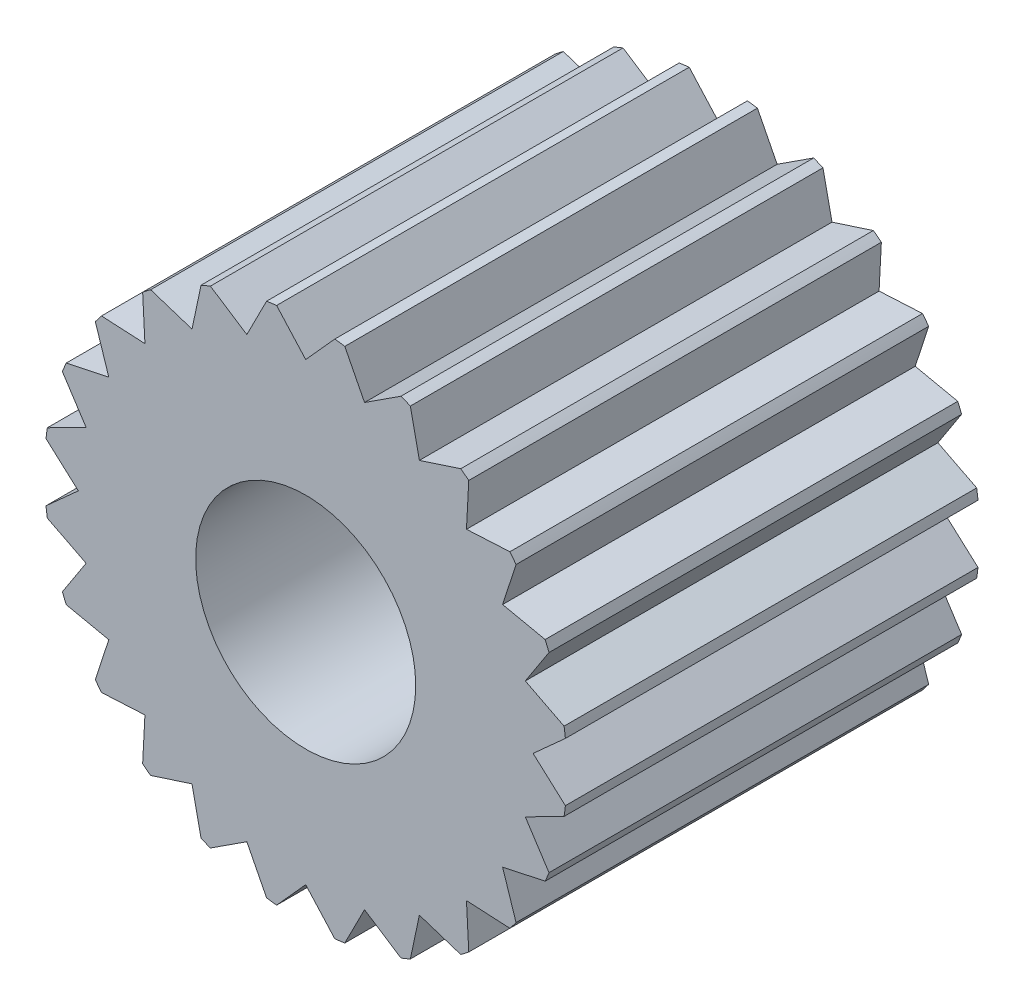
from build123d import *

# Parameters (mm, degrees)
ESBO_O1_R                = 1.9
ESBO_O1_R_2              = 0.8
RESSALTO_EXTRUS_O1_DEPTH = 3
CORTE_EXTRUS_O2_DEPTH    = 5.027406113


with BuildPart() as part:
    # Esboço1 → Ressalto-extrusão1 (new body)
    with BuildSketch(Plane.XY):
        Circle(ESBO_O1_R)
        Circle(ESBO_O1_R_2, mode=Mode.SUBTRACT)
    extrude(amount=RESSALTO_EXTRUS_O1_DEPTH)

    # Esboço2 → Corte-extrusão2 (cut, through all)
    with BuildSketch(Plane.XY.offset(3)):
        with BuildLine():
            Line((-0.211558753, 1.888185079), (0, 1.653119799))
            Line((0, 1.653119799), (0.211558753, 1.888185079))
            ThreePointArc((0.211558753, 1.888185079), (0, 1.9), (-0.211558753, 1.888185079))
        make_face()
        with BuildLine():
            ThreePointArc((0.693048322, 1.769091299), (0.491756186, 1.83525907), (0.284348196, 1.878602167))
            Line((0.284348196, 1.878602167), (0.427858888, 1.596791107))
            Line((0.427858888, 1.596791107), (0.693048322, 1.769091299))
        make_face()
        with BuildLine():
            Line((-0.427858888, 1.596791107), (-0.284348196, 1.878602167))
            ThreePointArc((-0.284348196, 1.878602167), (-0.491756186, 1.83525907), (-0.693048322, 1.769091299))
            Line((-0.693048322, 1.769091299), (-0.427858888, 1.596791107))
        make_face()
        with BuildLine():
            ThreePointArc((1.127307794, 1.529436869), (0.95, 1.645448267), (0.760877285, 1.740995622))
            Line((0.760877285, 1.740995622), (0.826559899, 1.431643741))
            Line((0.826559899, 1.431643741), (1.127307794, 1.529436869))
        make_face()
        with BuildLine():
            Line((-0.826559899, 1.431643741), (-0.760877285, 1.740995622))
            ThreePointArc((-0.760877285, 1.740995622), (-0.95, 1.645448267), (-1.127307794, 1.529436869))
            Line((-1.127307794, 1.529436869), (-0.826559899, 1.431643741))
        make_face()
        with BuildLine():
            ThreePointArc((1.484743102, 1.185553845), (1.343502884, 1.343502884), (1.185553845, 1.484743102))
            Line((1.185553845, 1.484743102), (1.16893222, 1.16893222))
            Line((1.16893222, 1.16893222), (1.484743102, 1.185553845))
        make_face()
        with BuildLine():
            Line((-1.16893222, 1.16893222), (-1.185553845, 1.484743102))
            ThreePointArc((-1.185553845, 1.484743102), (-1.343502884, 1.343502884), (-1.484743102, 1.185553845))
            Line((-1.484743102, 1.185553845), (-1.16893222, 1.16893222))
        make_face()
        with BuildLine():
            ThreePointArc((1.740995622, 0.760877285), (1.645448267, 0.95), (1.529436869, 1.127307794))
            Line((1.529436869, 1.127307794), (1.431643741, 0.826559899))
            Line((1.431643741, 0.826559899), (1.740995622, 0.760877285))
        make_face()
        with BuildLine():
            Line((-1.431643741, 0.826559899), (-1.529436869, 1.127307794))
            ThreePointArc((-1.529436869, 1.127307794), (-1.645448267, 0.95), (-1.740995622, 0.760877285))
            Line((-1.740995622, 0.760877285), (-1.431643741, 0.826559899))
        make_face()
        with BuildLine():
            ThreePointArc((1.878602167, 0.284348196), (1.83525907, 0.491756186), (1.769091299, 0.693048322))
            Line((1.769091299, 0.693048322), (1.596791107, 0.427858888))
            Line((1.596791107, 0.427858888), (1.878602167, 0.284348196))
        make_face()
        with BuildLine():
            Line((-1.596791107, 0.427858888), (-1.769091299, 0.693048322))
            ThreePointArc((-1.769091299, 0.693048322), (-1.83525907, 0.491756186), (-1.878602167, 0.284348196))
            Line((-1.878602167, 0.284348196), (-1.596791107, 0.427858888))
        make_face()
        with BuildLine():
            ThreePointArc((1.888185079, -0.211558753), (1.9, 0), (1.888185079, 0.211558753))
            Line((1.888185079, 0.211558753), (1.653119799, 0))
            Line((1.653119799, 0), (1.888185079, -0.211558753))
        make_face()
        with BuildLine():
            Line((-1.653119799, 0), (-1.888185079, 0.211558753))
            ThreePointArc((-1.888185079, 0.211558753), (-1.9, 0), (-1.888185079, -0.211558753))
            Line((-1.888185079, -0.211558753), (-1.653119799, 0))
        make_face()
        with BuildLine():
            Line((-1.596791107, -0.427858888), (-1.878602167, -0.284348196))
            ThreePointArc((-1.878602167, -0.284348196), (-1.83525907, -0.491756186), (-1.769091299, -0.693048322))
            Line((-1.769091299, -0.693048322), (-1.596791107, -0.427858888))
        make_face()
        with BuildLine():
            ThreePointArc((1.769091299, -0.693048322), (1.83525907, -0.491756186), (1.878602167, -0.284348196))
            Line((1.878602167, -0.284348196), (1.596791107, -0.427858888))
            Line((1.596791107, -0.427858888), (1.769091299, -0.693048322))
        make_face()
        with BuildLine():
            Line((-1.431643741, -0.826559899), (-1.740995622, -0.760877285))
            ThreePointArc((-1.740995622, -0.760877285), (-1.645448267, -0.95), (-1.529436869, -1.127307794))
            Line((-1.529436869, -1.127307794), (-1.431643741, -0.826559899))
        make_face()
        with BuildLine():
            ThreePointArc((1.529436869, -1.127307794), (1.645448267, -0.95), (1.740995622, -0.760877285))
            Line((1.740995622, -0.760877285), (1.431643741, -0.826559899))
            Line((1.431643741, -0.826559899), (1.529436869, -1.127307794))
        make_face()
        with BuildLine():
            Line((-1.16893222, -1.16893222), (-1.484743102, -1.185553845))
            ThreePointArc((-1.484743102, -1.185553845), (-1.343502884, -1.343502884), (-1.185553845, -1.484743102))
            Line((-1.185553845, -1.484743102), (-1.16893222, -1.16893222))
        make_face()
        with BuildLine():
            ThreePointArc((1.185553845, -1.484743102), (1.343502884, -1.343502884), (1.484743102, -1.185553845))
            Line((1.484743102, -1.185553845), (1.16893222, -1.16893222))
            Line((1.16893222, -1.16893222), (1.185553845, -1.484743102))
        make_face()
        with BuildLine():
            Line((-0.826559899, -1.431643741), (-1.127307794, -1.529436869))
            ThreePointArc((-1.127307794, -1.529436869), (-0.95, -1.645448267), (-0.760877285, -1.740995622))
            Line((-0.760877285, -1.740995622), (-0.826559899, -1.431643741))
        make_face()
        with BuildLine():
            ThreePointArc((0.760877285, -1.740995622), (0.95, -1.645448267), (1.127307794, -1.529436869))
            Line((1.127307794, -1.529436869), (0.826559899, -1.431643741))
            Line((0.826559899, -1.431643741), (0.760877285, -1.740995622))
        make_face()
        with BuildLine():
            Line((-0.427858888, -1.596791107), (-0.693048322, -1.769091299))
            ThreePointArc((-0.693048322, -1.769091299), (-0.491756186, -1.83525907), (-0.284348196, -1.878602167))
            Line((-0.284348196, -1.878602167), (-0.427858888, -1.596791107))
        make_face()
        with BuildLine():
            ThreePointArc((0.284348196, -1.878602167), (0.491756186, -1.83525907), (0.693048322, -1.769091299))
            Line((0.693048322, -1.769091299), (0.427858888, -1.596791107))
            Line((0.427858888, -1.596791107), (0.284348196, -1.878602167))
        make_face()
        with BuildLine():
            Line((0, -1.653119799), (-0.211558753, -1.888185079))
            ThreePointArc((-0.211558753, -1.888185079), (0, -1.9), (0.211558753, -1.888185079))
            Line((0.211558753, -1.888185079), (0, -1.653119799))
        make_face()
    extrude(amount=-CORTE_EXTRUS_O2_DEPTH, mode=Mode.SUBTRACT)


solid = part.part
